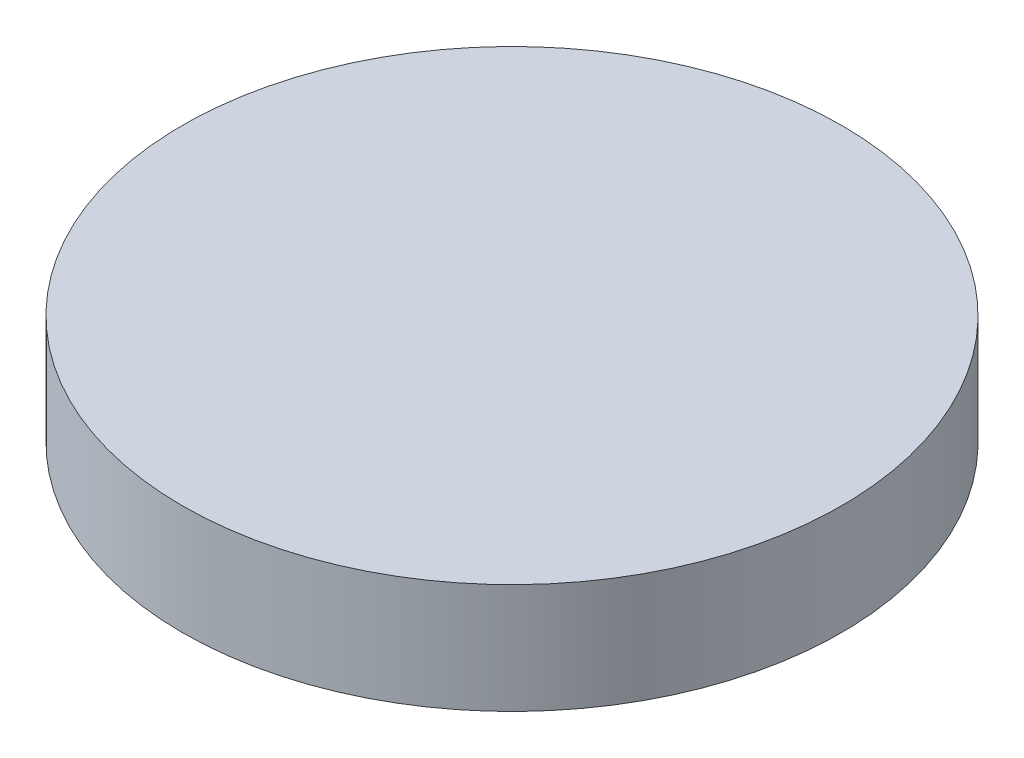
from build123d import *

# Parameters (mm, degrees)
SKETCH1_R           = 3
BOSS_EXTRUDE1_DEPTH = 1


with BuildPart() as part:
    # Sketch1 → Boss-Extrude1 (new body)
    with BuildSketch(Plane(origin=(0, 0, 0), x_dir=(1, 0, 0), z_dir=(0, 1, 0))):
        with Locations(Location((0, 0, 0), (0, 0, 270))):
            Circle(SKETCH1_R)
    extrude(amount=BOSS_EXTRUDE1_DEPTH)


solid = part.part
